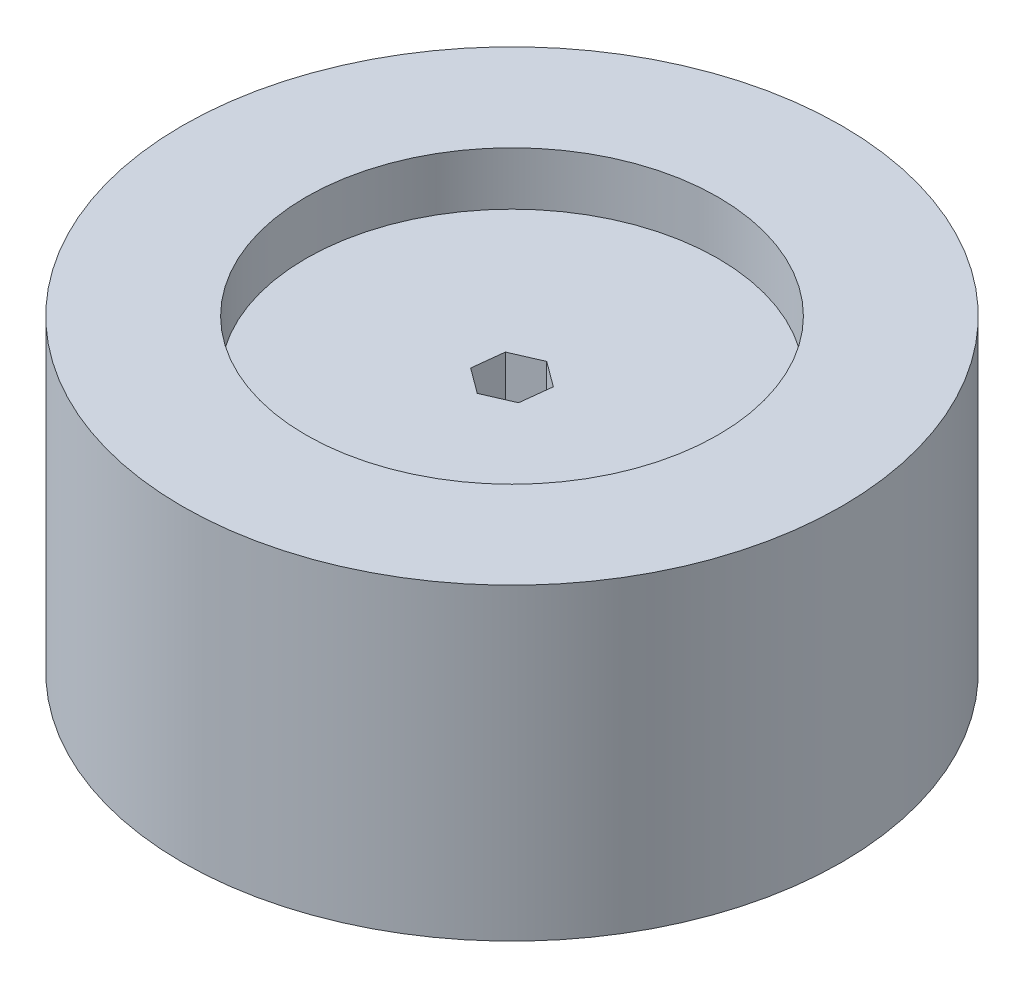
from build123d import *

# Parameters (mm, degrees)
SKETCH_1_R          = 40
EXTRUDE_1_DEPTH     = 37.4
CUT_EXTRUDE_1_DEPTH = 16.7
SKETCH_3_R          = 25
CUT_EXTRUDE_2_DEPTH = 6.45
SKETCH_4_R          = 1.5
CUT_EXTRUDE_3_DEPTH = 61.236948794


with BuildPart() as part:
    # 草图1 → 凸台-拉伸1 (new body)
    with BuildSketch(Plane(origin=(0, 0, 0), x_dir=(1, 0, 0), z_dir=(0, 1, 0))):
        with Locations(Location((0, 0, 0), (0, 0, 270))):
            Circle(SKETCH_1_R)
    extrude(amount=EXTRUDE_1_DEPTH)

    # 草图2 → 切除-拉伸1 (cut)
    with BuildSketch(Plane(origin=(0, 37.4, 0), x_dir=(1, 0, 0), z_dir=(0, 1, 0))):
        Polygon((3.493353, 1.52200027), (0.428585602, 3.786332577), (-3.064767398, 2.264332307), (-3.493353, -1.52200027), (-0.428585602, -3.786332577), (3.064767398, -2.264332307), align=None)
    cut_extrude_1 = extrude(amount=-CUT_EXTRUDE_1_DEPTH, mode=Mode.SUBTRACT)

    # 草图3 → 切除-拉伸2 (cut)
    with BuildSketch(Plane(origin=(0, 37.4, 0), x_dir=(1, 0, 0), z_dir=(0, 1, 0))):
        with Locations(Location((0, 0, 0), (0, 0, 270))):
            Circle(SKETCH_3_R)
    cut_extrude_2 = extrude(amount=-CUT_EXTRUDE_2_DEPTH, mode=Mode.SUBTRACT)

    # 草图4 → 切除-拉伸3 (cut, through all)
    with BuildSketch(Plane(origin=(0, 20.7, 0), x_dir=(1, 0, 0), z_dir=(0, 1, 0))):
        with Locations(Location((0, 0, 0), (0, 0, 270))):
            Circle(SKETCH_4_R)
    extrude(amount=-CUT_EXTRUDE_3_DEPTH, mode=Mode.SUBTRACT)

    # 镜向3: 切除-拉伸1, 切除-拉伸2 across plane
    add(cut_extrude_1.mirror(Plane.ZX.offset(18.7)), mode=Mode.SUBTRACT)
    add(cut_extrude_2.mirror(Plane.ZX.offset(18.7)), mode=Mode.SUBTRACT)


solid = part.part
